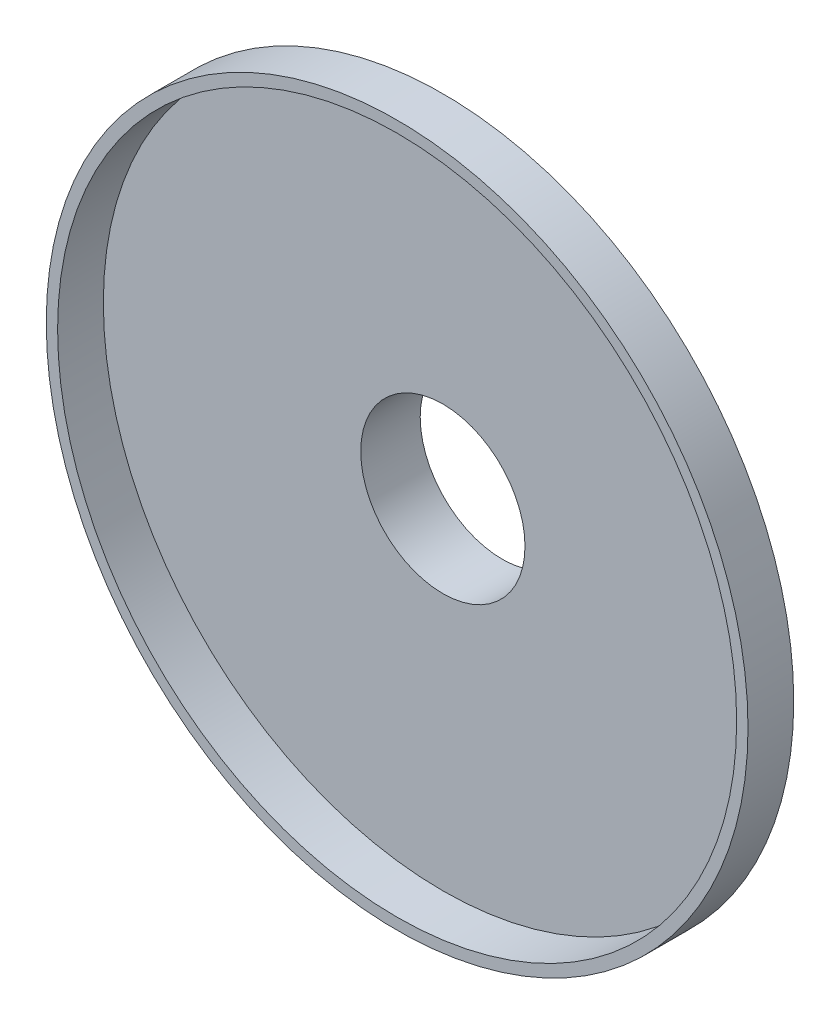
from build123d import *

# Parameters (mm, degrees)
SKETCH1_R                     = 76.73
BOSS_EXTRUDE1_DEPTH           = 10
BOSS_EXTRUDE1_OTHER_WAY_DEPTH = 8
BOSS_EXTRUDE1_OTHER_WAY_TAPER = 70
SKETCH2_R                     = 17.9565
CUT_EXTRUDE1_DEPTH            = 18
SKETCH3_R                     = 74.247849381
CUT_EXTRUDE2_DEPTH            = 10
BOSS_EXTRUDE2_START           = 5
SKETCH4_R                     = 19.169573719
SKETCH4_R_2                   = 17.9565
BOSS_EXTRUDE2_DEPTH           = 5


with BuildPart() as part:
    # Sketch1 → Boss-Extrude1 (new body)
    with BuildSketch(Plane.XY):
        Circle(SKETCH1_R)
    extrude(amount=BOSS_EXTRUDE1_DEPTH)

    # Sketch1 → Boss-Extrude1 other way (add)
    with BuildSketch(Plane.XY):
        Circle(SKETCH1_R)
    extrude(amount=-BOSS_EXTRUDE1_OTHER_WAY_DEPTH, taper=BOSS_EXTRUDE1_OTHER_WAY_TAPER)

    # Sketch2 → Cut-Extrude1 (cut)
    with BuildSketch(Plane(origin=(0, 0, -8), x_dir=(-1, 0, 0), z_dir=(0, 0, -1))):
        Circle(SKETCH2_R)
    extrude(amount=-CUT_EXTRUDE1_DEPTH, mode=Mode.SUBTRACT)

    # Sketch3 → Cut-Extrude2 (cut)
    with BuildSketch(Plane.XY.offset(10)):
        Circle(SKETCH3_R)
    extrude(amount=-CUT_EXTRUDE2_DEPTH, mode=Mode.SUBTRACT)

    # Sketch4 → Boss-Extrude2 (add)
    with BuildSketch(Plane(origin=(0, 0, -8), x_dir=(-1, 0, 0), z_dir=(0, 0, -1)).offset(BOSS_EXTRUDE2_START)):
        with Locations(Location((0, 0, 0), (0, 0, 180))):
            Circle(SKETCH4_R)
        Circle(SKETCH4_R_2, mode=Mode.SUBTRACT)
    extrude(amount=-BOSS_EXTRUDE2_DEPTH)


solid = part.part
